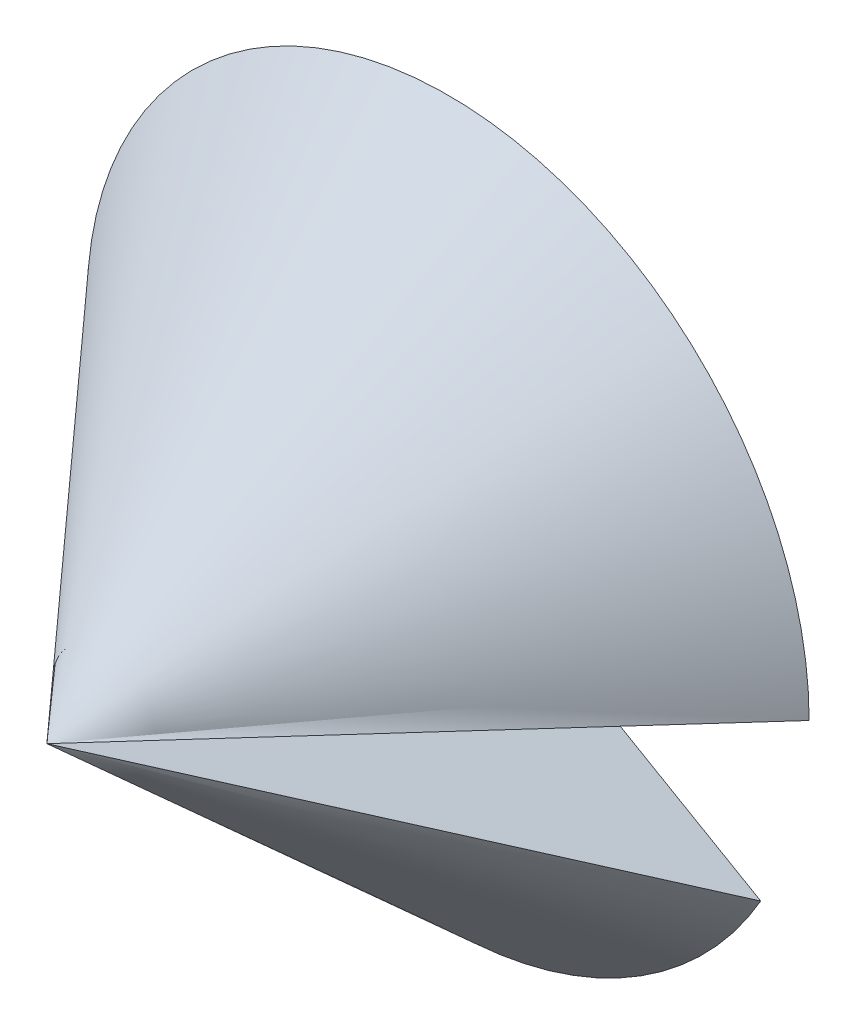
from build123d import *

# Parameters (mm, degrees)
REVOLVE3_ANGLE     = 330
REVOLVE7_ANGLE     = 30
SKETCH1_R          = 2
CUT_EXTRUDE2_DEPTH = 10


with BuildPart() as part:
    # Sketch4 → Revolve3 (revolve)
    with BuildSketch(Plane(origin=(0, 0, 0), x_dir=(1, 0, 0), z_dir=(0, 1, 0))):
        Polygon((0, -50), (45, 0), (0, 0), align=None)
    revolve(axis=Axis((0, 0, 0), (0, 0, 1)), revolution_arc=REVOLVE3_ANGLE)


with BuildPart() as body_2:
    # Sketch7 → Revolve7 (revolve)
    with BuildSketch(Plane(origin=(0, 0, 0), x_dir=(1, 0, 0), z_dir=(0, 1, 0))):
        Polygon((0, -50), (23.719550692, 0), (17.405636357, 0), (0, 0), align=None)
    revolve(axis=Axis((0, 0, 0), (0, 0, -1)), revolution_arc=REVOLVE7_ANGLE)


with BuildPart() as cut_extrude2_tool:
    # Sketch1 → Cut-Extrude2 (new body)
    with BuildSketch(Plane.XY):
        Circle(SKETCH1_R)
    extrude(amount=CUT_EXTRUDE2_DEPTH)


with BuildPart() as part_1:
    add(part.part)

    # Cut-Extrude2: cut by cut_extrude2_tool
    add(cut_extrude2_tool.part, mode=Mode.SUBTRACT)


with BuildPart() as body_2_1:
    add(body_2.part)

    # Cut-Extrude2: cut by cut_extrude2_tool
    add(cut_extrude2_tool.part, mode=Mode.SUBTRACT)


solid = Compound([part_1.part, body_2_1.part])
